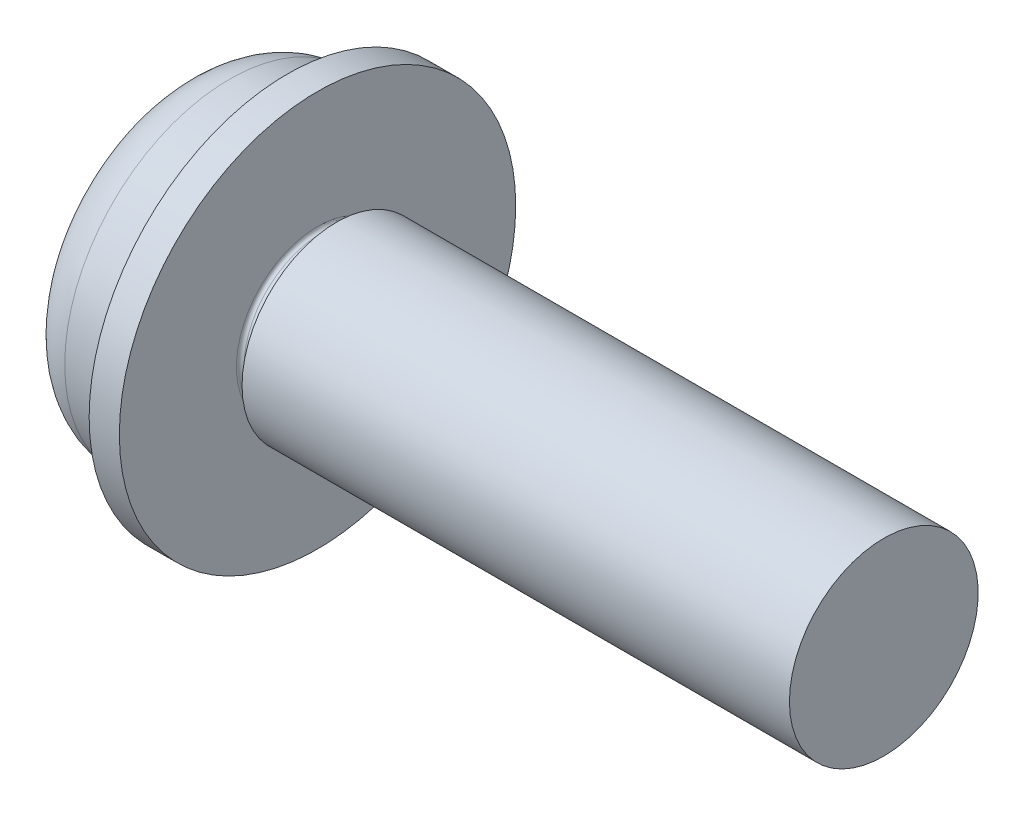
from build123d import *

# Parameters (mm, degrees)
CUT_EXTRUDE_1_DEPTH = 2
CUT_EXTRUDE_1_TAPER = 5
FILLET_1_R          = 0.1


with BuildPart() as part:
    # ｽｹｯﾁ1 → Revolve 858 (revolve)
    with BuildSketch(Plane.XY):
        with BuildLine():
            Line((-2.330370339, 4.366109944), (-0.8, 4.5))
            Line((-0.8, 4.5), (-0.8, 5.25))
            Line((-0.8, 5.25), (0, 5.25))
            Line((0, 5.25), (0, 2.05))
            Line((0, 2.05), (0.5, 2.05))
            Line((0.5, 2.05), (0.5, 2.5))
            Line((0.5, 2.5), (15, 2.5))
            Line((15, 2.5), (15, 0))
            Line((15, 0), (-4.1, 0))
            ThreePointArc((-4.1, 0), (-3.985060026, 1.656909224), (-3.642441971, 3.282077597))
            ThreePointArc((-3.642441971, 3.282077597), (-3.155035944, 4.028196871), (-2.330370339, 4.366109944))
        make_face()
    revolve(axis=Axis((0, 0, 0), (1, 0, 0)))

    # ｽｹｯﾁ2 → ｶｯﾄ - 押し出し1 (cut)
    with BuildSketch(Plane(origin=(-4.1, 0, 0), x_dir=(0, 0, -1), z_dir=(1, 0, 0))):
        with BuildLine():
            Line((0.515, -2.5), (0.515, -0.815))
            ThreePointArc((0.515, -0.815), (0.602867966, -0.602867966), (0.815, -0.515))
            Line((0.815, -0.515), (2.5, -0.515))
            Line((2.5, -0.515), (2.5, 0.515))
            Line((2.5, 0.515), (0.815, 0.515))
            ThreePointArc((0.815, 0.515), (0.602867966, 0.602867966), (0.515, 0.815))
            Line((0.515, 0.815), (0.515, 2.5))
            Line((0.515, 2.5), (-0.515, 2.5))
            Line((-0.515, 2.5), (-0.515, 0.815))
            ThreePointArc((-0.515, 0.815), (-0.602867966, 0.602867966), (-0.815, 0.515))
            Line((-0.815, 0.515), (-2.5, 0.515))
            Line((-2.5, 0.515), (-2.5, -0.515))
            Line((-2.5, -0.515), (-0.815, -0.515))
            ThreePointArc((-0.815, -0.515), (-0.602867966, -0.602867966), (-0.515, -0.815))
            Line((-0.515, -0.815), (-0.515, -2.5))
            Line((-0.515, -2.5), (0.515, -2.5))
        make_face()
    extrude(amount=CUT_EXTRUDE_1_DEPTH, taper=CUT_EXTRUDE_1_TAPER, mode=Mode.SUBTRACT)

    # ﾌｨﾚｯﾄ1
    fillet_1_edges = [part.edges().sort_by_distance(p)[0] for p in [
        (0, -2.05, 0),
    ]]
    fillet(fillet_1_edges, radius=FILLET_1_R)


solid = part.part
